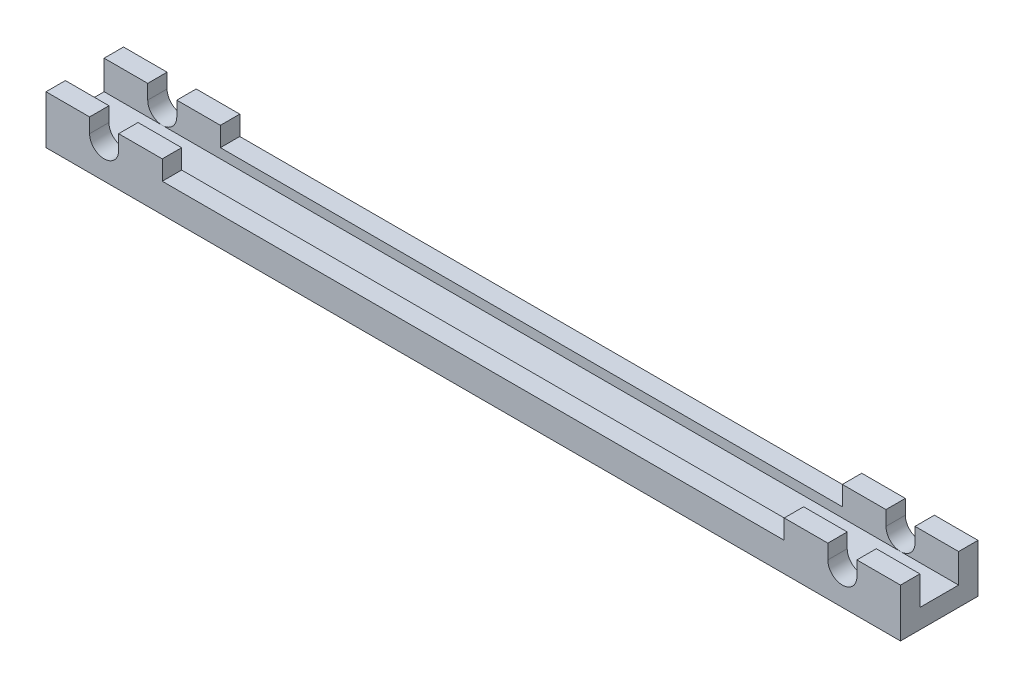
from build123d import *

# Parameters (mm, degrees)
SKETCH1_W           = 44.1
SKETCH1_H           = 8
BOSS_EXTRUDE1_DEPTH = 2
SKETCH2_W           = 12
SKETCH2_H           = 2
BOSS_EXTRUDE2_DEPTH = 3
CUT_EXTRUDE1_DEPTH  = 46.097782651
SKETCH4_W           = 32.1
SKETCH4_H           = 2
BOSS_EXTRUDE3_DEPTH = 1


with BuildPart() as part:
    # Sketch1 → Boss-Extrude1 (new body)
    with BuildSketch(Plane(origin=(0, 0, 0), x_dir=(1, 0, 0), z_dir=(0, 1, 0))):
        with Locations((22.05, 0)):
            Rectangle(SKETCH1_W, SKETCH1_H)
    boss_extrude1 = extrude(amount=BOSS_EXTRUDE1_DEPTH)

    # Sketch2 → Boss-Extrude2 (add)
    with BuildSketch(Plane(origin=(0, 2, 0), x_dir=(1, 0, 0), z_dir=(0, 1, 0))):
        with Locations((38.1, 3)):
            Rectangle(SKETCH2_W, SKETCH2_H)
        with Locations((38.1, -3)):
            Rectangle(SKETCH2_W, SKETCH2_H)
    boss_extrude2 = extrude(amount=BOSS_EXTRUDE2_DEPTH)

    # Sketch3 → Cut-Extrude1 (cut, through all)
    with BuildSketch(Plane.XY.offset(4)):
        with BuildLine():
            Line((36.6, 3.5), (36.6, 5))
            Line((36.6, 5), (39.6, 5))
            Line((39.6, 5), (39.6, 3.5))
            ThreePointArc((39.6, 3.5), (38.1, 2), (36.6, 3.5))
        make_face()
    cut_extrude1 = extrude(amount=-CUT_EXTRUDE1_DEPTH, mode=Mode.SUBTRACT)

    # Sketch4 → Boss-Extrude3 (add)
    with BuildSketch(Plane(origin=(0, 2, 0), x_dir=(1, 0, 0), z_dir=(0, 1, 0))):
        with Locations((16.05, -3)):
            Rectangle(SKETCH4_W, SKETCH4_H)
        with Locations((16.05, 3)):
            Rectangle(SKETCH4_W, SKETCH4_H)
    boss_extrude3 = extrude(amount=BOSS_EXTRUDE3_DEPTH)

    # Mirror1: Boss-Extrude1, Boss-Extrude2, Cut-Extrude1, Boss-Extrude3 across plane
    add(boss_extrude1.mirror(Plane(origin=(0, 0, 0), x_dir=(0, 0, 1), z_dir=(1, 0, 0))))
    add(boss_extrude2.mirror(Plane(origin=(0, 0, 0), x_dir=(0, 0, 1), z_dir=(1, 0, 0))))
    add(cut_extrude1.mirror(Plane(origin=(0, 0, 0), x_dir=(0, 0, 1), z_dir=(1, 0, 0))), mode=Mode.SUBTRACT)
    add(boss_extrude3.mirror(Plane(origin=(0, 0, 0), x_dir=(0, 0, 1), z_dir=(1, 0, 0))))


solid = part.part
